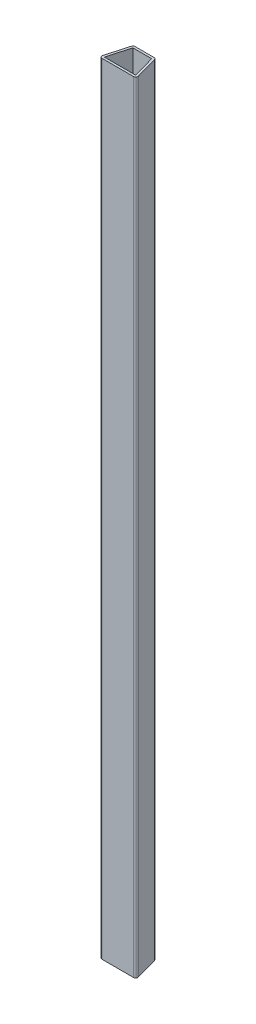
from build123d import *

# Parameters (mm, degrees)
BOSS_EXTRUDE1_DEPTH = 350


with BuildPart() as part:
    # Sketch1 → Boss-Extrude1 (new body)
    with BuildSketch(Plane(origin=(0, 0, 0), x_dir=(1, 0, 0), z_dir=(0, 1, 0))):
        with BuildLine():
            Line((-7.039855599, -6), (7.039855599, -6))
            ThreePointArc((7.039855599, -6), (7.836958346, -5.603843698), (8.002506539, -4.729254423))
            Line((8.002506539, -4.729254423), (5.190006539, 5.270745577))
            ThreePointArc((5.190006539, 5.270745577), (4.831199297, 5.797102746), (4.227355599, 6))
            Line((4.227355599, 6), (-4.227355599, 6))
            ThreePointArc((-4.227355599, 6), (-4.831199297, 5.797102746), (-5.190006539, 5.270745577))
            Line((-5.190006539, 5.270745577), (-8.002506539, -4.729254423))
            ThreePointArc((-8.002506539, -4.729254423), (-7.836958346, -5.603843698), (-7.039855599, -6))
        make_face()
        Polygon((-7.039855599, -5), (7.039855599, -5), (4.227355599, 5), (-4.227355599, 5), align=None, mode=Mode.SUBTRACT)
    extrude(amount=BOSS_EXTRUDE1_DEPTH)


solid = part.part
